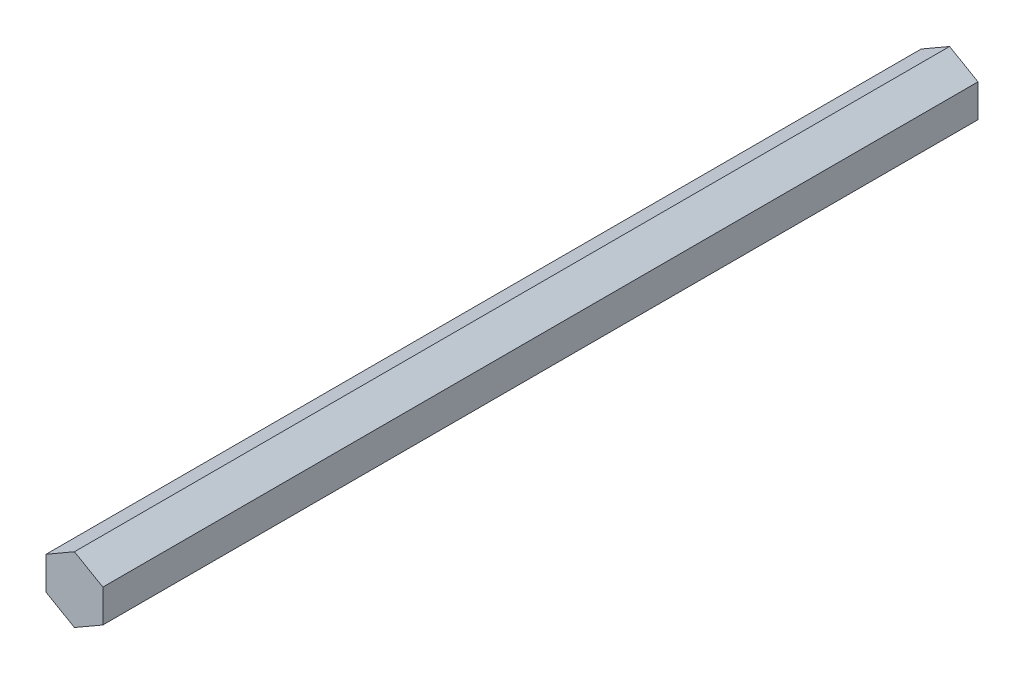
from build123d import *

# Parameters (mm, degrees)
EXTRUDE_1_DEPTH = 40


with BuildPart() as part:
    # ｽｹｯﾁ1 → ﾎﾞｽ - 押し出し1 (new body)
    with BuildSketch(Plane.XY):
        Polygon((0, 1.5), (-1.299038106, 0.75), (-1.299038106, -0.75), (0, -1.5), (1.299038106, -0.75), (1.299038106, 0.75), align=None)
    extrude(amount=EXTRUDE_1_DEPTH)


solid = part.part
